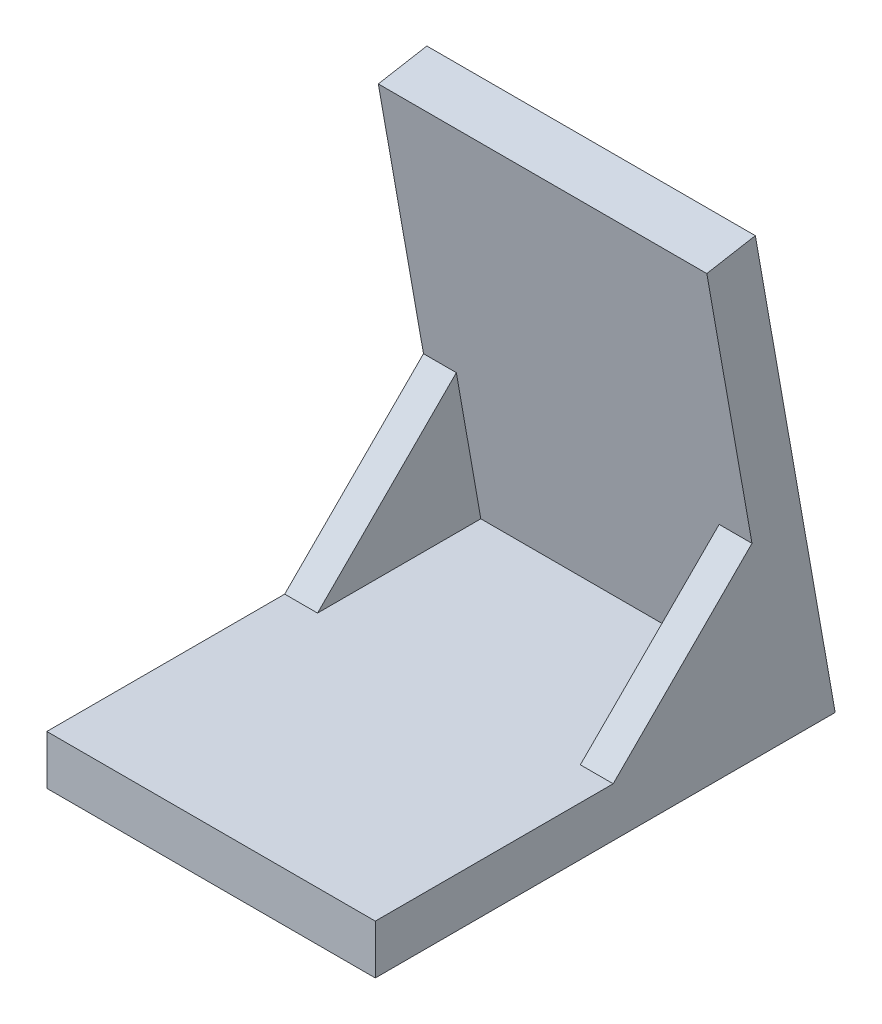
from build123d import *

# Parameters (mm, degrees)
BOSS_EXTRUDE1_DEPTH      = 50
BOSS_EXTRUDE1_DEPTH_BACK = 50
RIB1_REACH               = 222.474
SKETCH3_WALL_W           = 502.70716346
SKETCH3_WALL_H           = 10


with BuildPart() as part:
    # Sketch1 → Boss-Extrude1 (new, two sides: drawn at the far end of the back side and taken through both)
    with BuildSketch(Plane(origin=(0, 0, 0), x_dir=(0, 0, -1), z_dir=(1, 0, 0)).offset(-BOSS_EXTRUDE1_DEPTH_BACK)):
        Polygon((0, 0), (140, 0), (115.689255127, 137.873085422), (100.917138831, 135.268362757), (122.123696111, 15), (0, 15), align=None)
    extrude(amount=BOSS_EXTRUDE1_DEPTH + BOSS_EXTRUDE1_DEPTH_BACK)

    # Sketch3 wall → Rib1 (add, up to next)
    with BuildSketch(Plane(origin=(-50, 36.127729317, -93.545189355), x_dir=(0, -0.707106781187, 0.707106781187), z_dir=(0, 0.707106781187, 0.707106781187)), mode=Mode.PRIVATE) as rib1_sk1:
        with Locations((0, 5)):
            Rectangle(SKETCH3_WALL_W, SKETCH3_WALL_H)
    rib1_tool1 = extrude(rib1_sk1.sketch, amount=-RIB1_REACH, mode=Mode.PRIVATE) - part.part
    rib1 = rib1_tool1.solids().sort_by_distance((-50, 36.127729317, -93.545189355))[0]
    add(rib1)

    # Mirror1: Rib1 across plane
    add(rib1.mirror(Plane(origin=(0, 0, 0), x_dir=(0, 0, 1), z_dir=(1, 0, 0))))


solid = part.part
